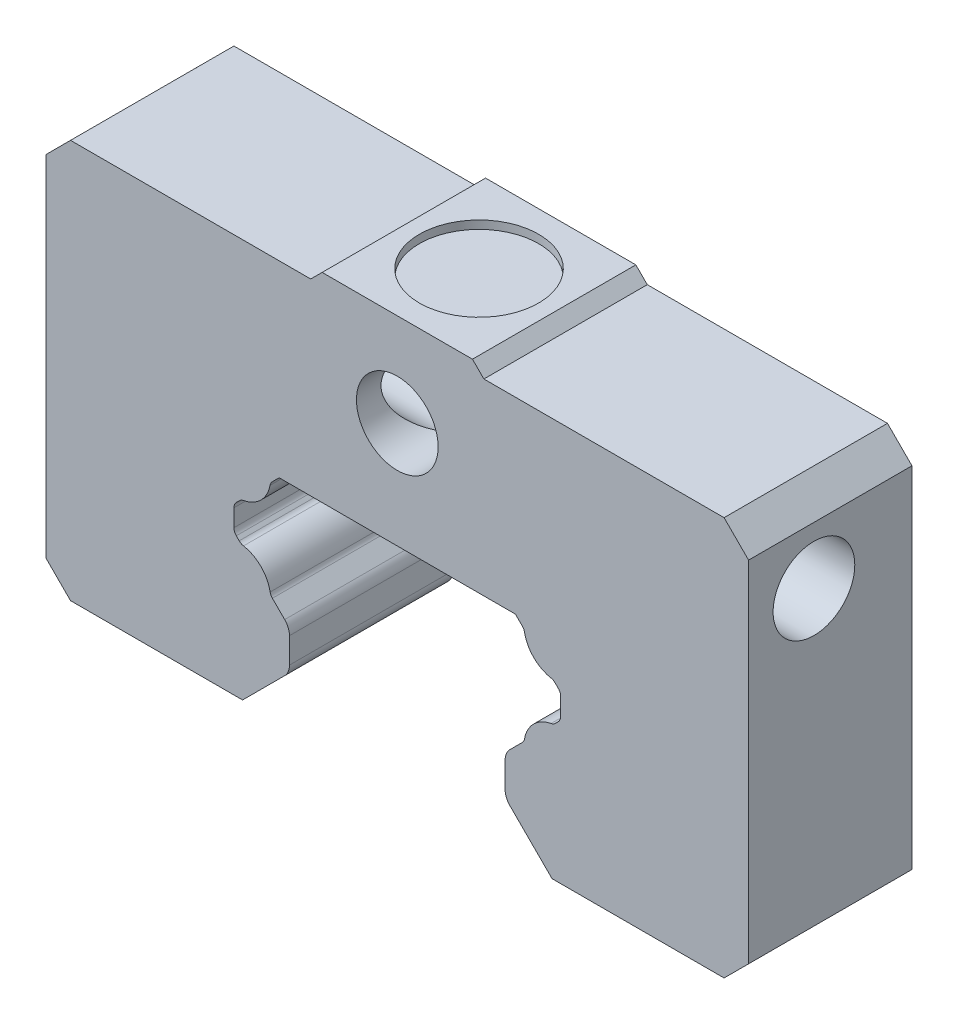
from build123d import *

# Parameters (mm, degrees)
ENDCAP_1_DEPTH                  = 10
TAP_DRILL_FOR_M6X1_0_TAP1_D     = 5
TAP_DRILL_FOR_M6X1_0_TAP1_DEPTH = 12.5
TAP_DRILL_FOR_M6X1_0_TAP1_TIP   = 1.301417626
TAP_DRILL_FOR_M6X1_0_TAP2_D     = 5
SKETCH9_R                       = 3.65
CUT_EXTRUDE1_DEPTH              = 0.5


with BuildPart() as part:
    # Sketch3 → Endcap 1 (new body)
    with BuildSketch(Plane.XY):
        with BuildLine():
            Line((-7.230720611, 12.9), (7.230720611, 12.9))
            Line((7.230720611, 12.9), (7.647672674, 12.483047938))
            ThreePointArc((7.647672674, 12.483047938), (7.736182466, 12.363118479), (7.785406885, 12.222427275))
            ThreePointArc((7.785406885, 12.222427275), (8.344607784, 11.164307384), (9.402727675, 10.605106485))
            ThreePointArc((9.402727675, 10.605106485), (9.54341888, 10.555882066), (9.663348338, 10.467372274))
            Line((9.663348338, 10.467372274), (9.853553391, 10.277167221))
            ThreePointArc((9.853553391, 10.277167221), (9.961939766, 10.114955546), (10, 9.92361383))
            Line((10, 9.92361383), (10, 8.86638617))
            ThreePointArc((10, 8.86638617), (9.961939766, 8.675044454), (9.853553391, 8.512832779))
            Line((9.853553391, 8.512832779), (9.675343394, 8.334622782))
            ThreePointArc((9.675343394, 8.334622782), (9.554347216, 8.245550888), (9.412352167, 8.19644607))
            ThreePointArc((9.412352167, 8.19644607), (8.344607784, 7.635448616), (7.783610331, 6.567704234))
            ThreePointArc((7.783610331, 6.567704234), (7.734505512, 6.425709184), (7.645433618, 6.304713007))
            Line((7.645433618, 6.304713007), (6.892893219, 5.552172608))
            ThreePointArc((6.892893219, 5.552172608), (6.676120468, 5.227749259), (6.6, 4.845065826))
            Line((6.6, 4.845065826), (6.6, 3.284934173))
            ThreePointArc((6.6, 3.284934173), (6.676120468, 2.902250741), (6.892893219, 2.577827392))
            Line((6.892893219, 2.577827392), (9.470720611, 0))
            Line((9.470720611, 0), (19.9998779, 0))
            Line((19.9998779, 0), (21.5, 1.5))
            Line((21.5, 1.5), (21.5, 22.9))
            Line((21.5, 22.9), (20.0001221, 24.4))
            Line((20.0001221, 24.4), (5.3001221, 24.4))
            Line((5.3001221, 24.4), (4.6001221, 25.1))
            Line((4.6001221, 25.1), (-4.5998779, 25.1))
            Line((-4.5998779, 25.1), (-5.2998779, 24.4))
            Line((-5.2998779, 24.4), (-19.9998779, 24.4))
            Line((-19.9998779, 24.4), (-21.5, 22.8997558))
            Line((-21.5, 22.8997558), (-21.5, 1.5))
            Line((-21.5, 1.5), (-19.9998779, 0))
            Line((-19.9998779, 0), (-9.470720611, 0))
            Line((-9.470720611, 0), (-6.892893219, 2.577827392))
            ThreePointArc((-6.892893219, 2.577827392), (-6.676120468, 2.902250741), (-6.6, 3.284934173))
            Line((-6.6, 3.284934173), (-6.6, 4.845065826))
            ThreePointArc((-6.6, 4.845065826), (-6.676120468, 5.227749259), (-6.892893219, 5.552172608))
            Line((-6.892893219, 5.552172608), (-7.645433618, 6.304713006))
            ThreePointArc((-7.645433618, 6.304713006), (-7.734505512, 6.425709184), (-7.783610331, 6.567704233))
            ThreePointArc((-7.783610331, 6.567704233), (-8.344607784, 7.635448616), (-9.412352167, 8.19644607))
            ThreePointArc((-9.412352167, 8.19644607), (-9.554347216, 8.245550888), (-9.675343394, 8.334622782))
            Line((-9.675343394, 8.334622782), (-9.853553391, 8.512832779))
            ThreePointArc((-9.853553391, 8.512832779), (-9.961939766, 8.675044454), (-10, 8.86638617))
            Line((-10, 8.86638617), (-10, 9.92361383))
            ThreePointArc((-10, 9.92361383), (-9.961939766, 10.114955546), (-9.853553391, 10.277167221))
            Line((-9.853553391, 10.277167221), (-9.663348338, 10.467372274))
            ThreePointArc((-9.663348338, 10.467372274), (-9.543418879, 10.555882066), (-9.402727675, 10.605106485))
            ThreePointArc((-9.402727675, 10.605106485), (-8.344607784, 11.164307384), (-7.785406885, 12.222427275))
            ThreePointArc((-7.785406885, 12.222427275), (-7.736182466, 12.363118479), (-7.647672674, 12.483047938))
            Line((-7.647672674, 12.483047938), (-7.230720611, 12.9))
        make_face()
    extrude(amount=ENDCAP_1_DEPTH)

    # Tap Drill for M6x1.0 Tap1
    with Locations(Plane.XY.offset(10)):
        with Locations((0, 19.4)):
            Hole(TAP_DRILL_FOR_M6X1_0_TAP1_D / 2, depth=TAP_DRILL_FOR_M6X1_0_TAP1_DEPTH)
            with Locations((0, 0, -(TAP_DRILL_FOR_M6X1_0_TAP1_DEPTH + TAP_DRILL_FOR_M6X1_0_TAP1_TIP / 2))):  # 125° drill point
                Cone(0, TAP_DRILL_FOR_M6X1_0_TAP1_D / 2, TAP_DRILL_FOR_M6X1_0_TAP1_TIP, mode=Mode.SUBTRACT)

    # Tap Drill for M6x1.0 Tap2 (through all)
    with Locations(Plane(origin=(21.5, 0, 0), x_dir=(0, 0, -1), z_dir=(1, 0, 0))):
        with Locations((-6, 19.4)):
            Hole(TAP_DRILL_FOR_M6X1_0_TAP2_D / 2)

    # Sketch9 → Cut-Extrude1 (cut)
    with BuildSketch(Plane(origin=(0, 25.1, 0), x_dir=(1, 0, 0), z_dir=(0, 1, 0))):
        with Locations((0.0001221, -5)):
            Circle(SKETCH9_R)
    extrude(amount=-CUT_EXTRUDE1_DEPTH, mode=Mode.SUBTRACT)


solid = part.part
